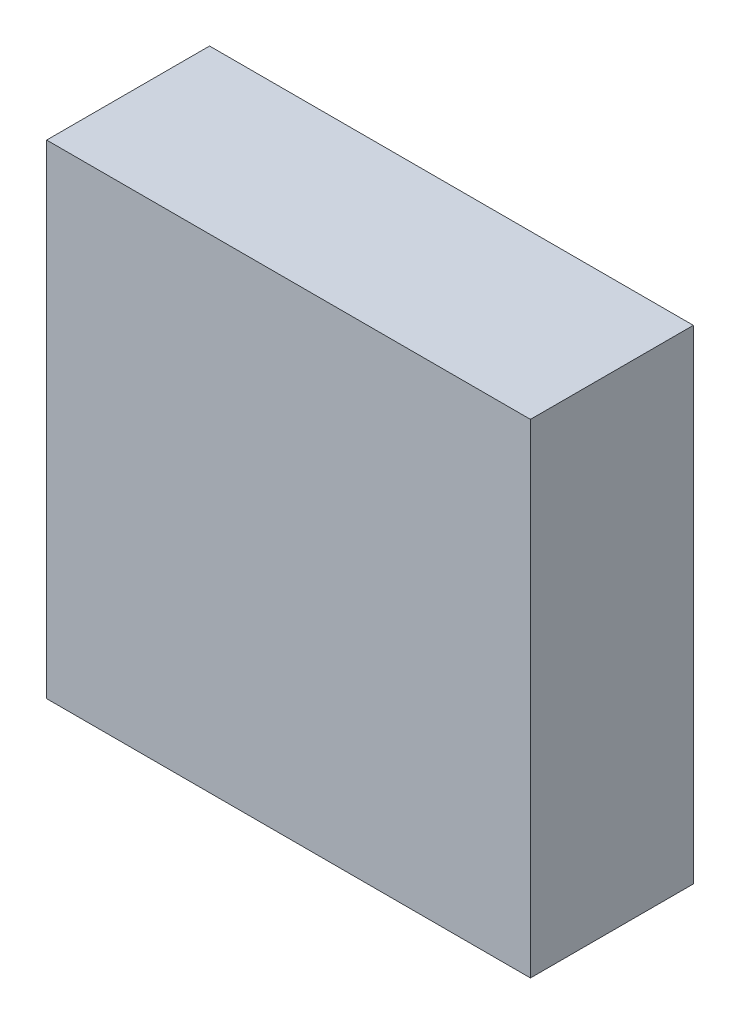
from build123d import *

# Parameters (mm, degrees)
SKETCH1_W           = 297
SKETCH1_H           = 297
BOSS_EXTRUDE1_DEPTH = 100


with BuildPart() as part:
    # Sketch1 → Boss-Extrude1 (new body)
    with BuildSketch(Plane.XY):
        with Locations((148.5, -148.5)):
            Rectangle(SKETCH1_W, SKETCH1_H)
    extrude(amount=BOSS_EXTRUDE1_DEPTH)


solid = part.part
